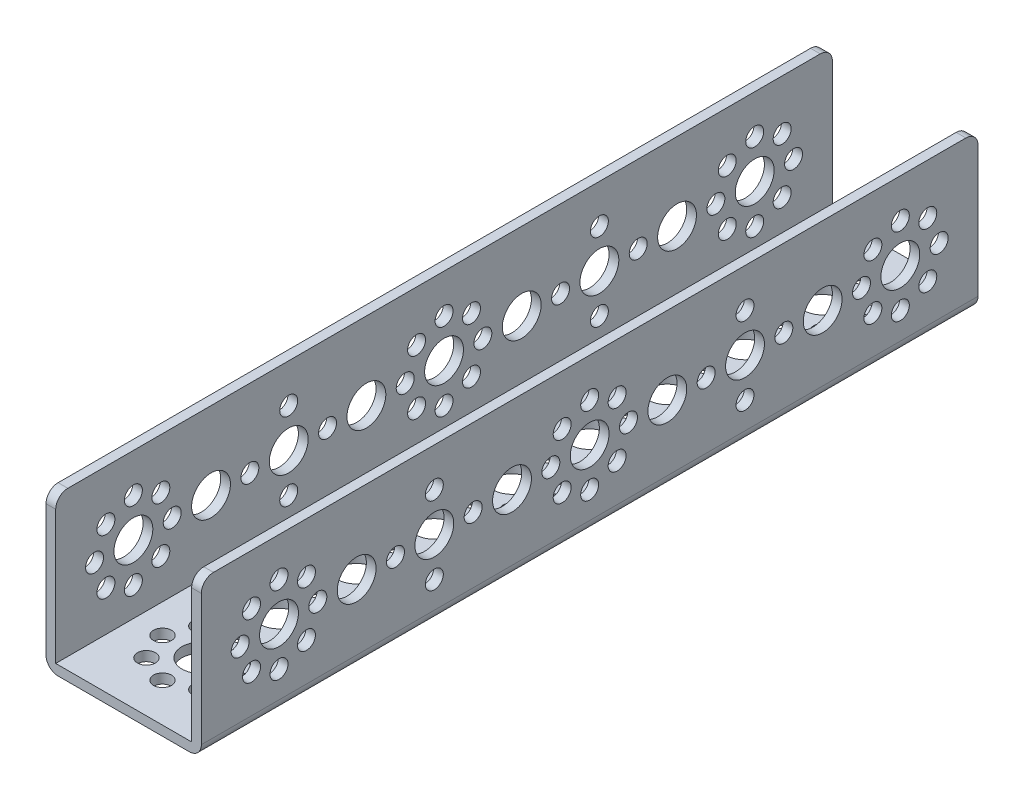
from build123d import *

# Parameters (mm, degrees)
SKETCH1_W                      = 160
SKETCH1_H                      = 32
BOSS_EXTRUDE1_DEPTH            = 32
SKETCH2_W                      = 28
SKETCH2_H                      = 30
CUT_EXTRUDE1_DEPTH             = 164.951212255
F_8_0_8_DIAMETER_HOLE1_D       = 8
F_8_0_8_DIAMETER_HOLE1_DEPTH   = 2
F_3_7_3_7_DIAMETER_HOLE1_D     = 3.7
F_3_7_3_7_DIAMETER_HOLE1_DEPTH = 2
F_3_7_3_7_DIAMETER_HOLE2_D     = 3.7
F_3_7_3_7_DIAMETER_HOLE2_DEPTH = 32
F_8_0_8_DIAMETER_HOLE2_D       = 8
F_8_0_8_DIAMETER_HOLE2_DEPTH   = 32
F_8_0_8_DIAMETER_HOLE3_D       = 8
F_8_0_8_DIAMETER_HOLE4_D       = 8
F_8_0_8_DIAMETER_HOLE4_DEPTH   = 32
F_3_7_3_7_DIAMETER_HOLE3_D     = 3.7
F_3_7_3_7_DIAMETER_HOLE3_DEPTH = 32
FILLET1_R                      = 2.5


with BuildPart() as part:
    # Sketch1 → Boss-Extrude1 (new body)
    with BuildSketch(Plane(origin=(16, 0, 0), x_dir=(0, 0, -1), z_dir=(1, 0, 0))):
        with Locations((64, 16)):
            Rectangle(SKETCH1_W, SKETCH1_H)
    extrude(amount=-BOSS_EXTRUDE1_DEPTH)

    # Sketch2 → Cut-Extrude1 (cut, through all)
    with BuildSketch(Plane(origin=(0, 0, -144), x_dir=(-1, 0, 0), z_dir=(0, 0, -1))):
        with Locations((0, 17)):
            Rectangle(SKETCH2_W, SKETCH2_H)
    extrude(amount=-CUT_EXTRUDE1_DEPTH, mode=Mode.SUBTRACT)

    # Ø8.0 (8) Diameter Hole1
    with Locations(Plane.ZY.offset(16)):
        with Locations((-64, 16), (-128, 16), (-32, 16), (-96, 16), (-16, 16), (-48, 16), (-80, 16), (-112, 16), (0, 16)):
            Hole(F_8_0_8_DIAMETER_HOLE1_D / 2, depth=F_8_0_8_DIAMETER_HOLE1_DEPTH)

    # Ø3.7 (3.7) Diameter Hole1
    with Locations(Plane.ZY.offset(16)):
        with Locations((0, 24), (0, 8), (-8, 16), (8, 16), (-5.656854249, 21.656854249), (5.656854249, 21.656854249), (5.656854249, 10.343145751), (-5.656854249, 10.343145751), (-64, 24), (-64, 8), (-72, 16), (-56, 16), (-69.656854249, 21.656854249), (-58.343145751, 21.656854249), (-58.343145751, 10.343145751), (-69.656854249, 10.343145751), (-128, 24), (-128, 8), (-136, 16), (-120, 16), (-133.656854249, 21.656854249), (-122.34314575, 21.656854249), (-122.34314575, 10.343145751), (-133.656854249, 10.343145751), (-32, 24), (-40, 16), (-32, 8), (-24, 16), (-96, 24), (-104, 16), (-96, 8), (-88, 16)):
            Hole(F_3_7_3_7_DIAMETER_HOLE1_D / 2, depth=F_3_7_3_7_DIAMETER_HOLE1_DEPTH)

    # Ø3.7 (3.7) Diameter Hole2
    with Locations(Plane(origin=(0, 0, 0), x_dir=(-1, 0, 0), z_dir=(0, -1, 0))):
        with Locations((8, 0), (5.656854249, 5.656854249), (0, 8), (-5.656854249, 5.656854249), (-8, 0), (-5.656854249, -5.656854249), (0, -8), (5.656854249, -5.656854249), (8, 64), (5.656854249, 69.656854249), (0, 72), (-5.656854249, 69.656854249), (-8, 64), (-5.656854249, 58.343145751), (0, 56), (5.656854249, 58.343145751), (8, 128), (5.656854249, 133.656854249), (0, 136), (-5.656854249, 133.656854249), (-8, 128), (-5.656854249, 122.34314575), (0, 120), (5.656854249, 122.34314575), (8, 32), (0, 40), (-8, 32), (0, 24), (8, 96), (0, 104), (-8, 96), (0, 88)):
            Hole(F_3_7_3_7_DIAMETER_HOLE2_D / 2, depth=F_3_7_3_7_DIAMETER_HOLE2_DEPTH)

    # Ø8.0 (8) Diameter Hole2
    with Locations(Plane(origin=(0, 0, 0), x_dir=(-1, 0, 0), z_dir=(0, -1, 0))):
        with Locations((0, 0), (0, 64), (0, 128), (0, 32), (0, 96), (0, 16), (0, 48), (0, 80), (0, 112)):
            Hole(F_8_0_8_DIAMETER_HOLE2_D / 2, depth=F_8_0_8_DIAMETER_HOLE2_DEPTH)

    # Ø8.0 (8) Diameter Hole3 (through all)
    with Locations(Plane.ZY.offset(-14)):
        with Locations((-32, 16)):
            Hole(F_8_0_8_DIAMETER_HOLE3_D / 2)

    # Ø8.0 (8) Diameter Hole4
    with Locations(Plane(origin=(16, 0, 0), x_dir=(0, 0, -1), z_dir=(1, 0, 0))):
        with Locations((64, 16), (128, 16), (96, 16), (16, 16), (48, 16), (80, 16), (112, 16), (0, 16)):
            Hole(F_8_0_8_DIAMETER_HOLE4_D / 2, depth=F_8_0_8_DIAMETER_HOLE4_DEPTH)

    # Ø3.7 (3.7) Diameter Hole3
    with Locations(Plane(origin=(16, 0, 0), x_dir=(0, 0, -1), z_dir=(1, 0, 0))):
        with Locations((0, 24), (0, 8), (8, 16), (-8, 16), (5.656854249, 21.656854249), (-5.656854249, 21.656854249), (-5.656854249, 10.343145751), (5.656854249, 10.343145751), (64, 24), (64, 8), (72, 16), (56, 16), (69.656854249, 21.656854249), (58.343145751, 21.656854249), (58.343145751, 10.343145751), (69.656854249, 10.343145751), (128, 24), (128, 8), (136, 16), (120, 16), (133.656854249, 21.656854249), (122.34314575, 21.656854249), (122.34314575, 10.343145751), (133.656854249, 10.343145751), (32, 24), (40, 16), (32, 8), (24, 16), (96, 24), (104, 16), (96, 8), (88, 16)):
            Hole(F_3_7_3_7_DIAMETER_HOLE3_D / 2, depth=F_3_7_3_7_DIAMETER_HOLE3_DEPTH)

    # Fillet1
    fillet1_edges = [part.edges().sort_by_distance(p)[0] for p in [
        (-16, 0, -64),
        (15, 32, 16),
        (15, 32, -144),
        (16, 0, -64),
        (-15, 32, -144),
        (-15, 32, 16),
    ]]
    fillet(fillet1_edges, radius=FILLET1_R)


solid = part.part
